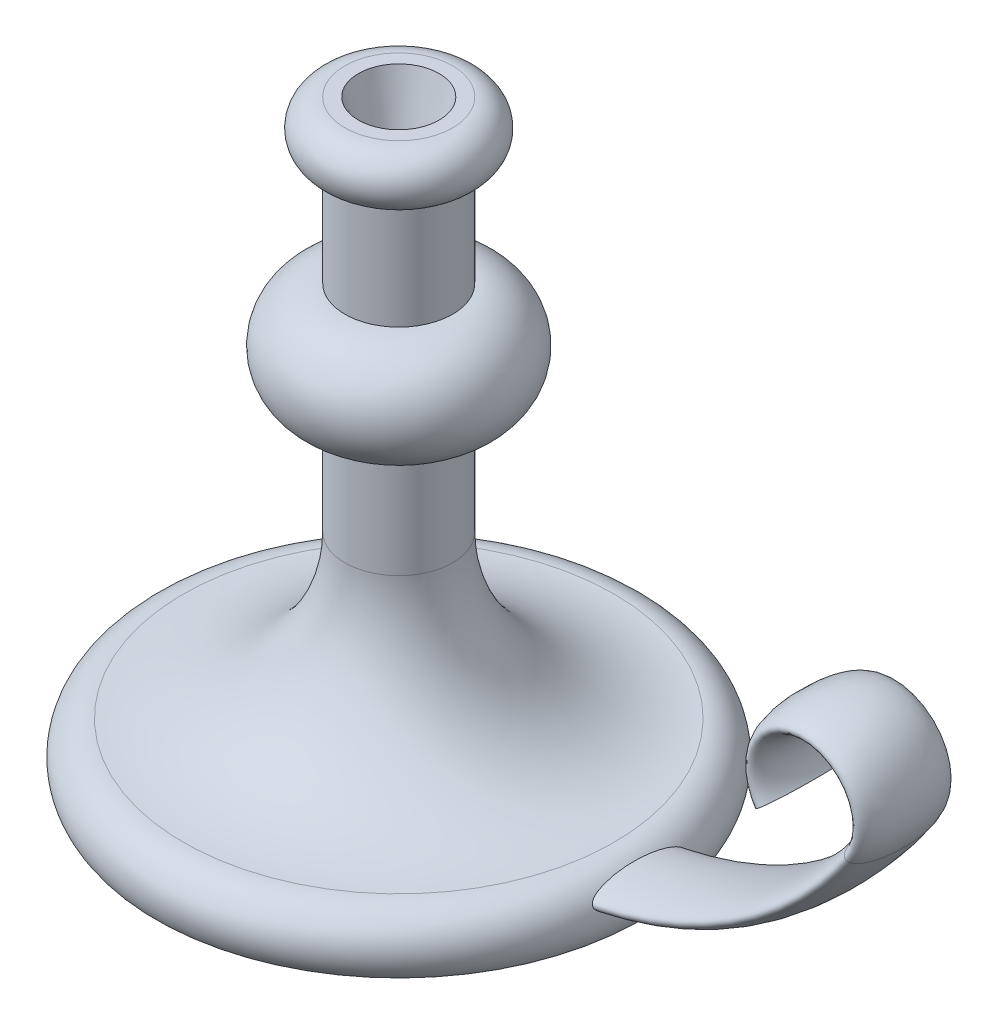
from build123d import *

# Parameters (mm, degrees)
SKETCH3_RX         = 17.5
SKETCH3_RY         = 5
SKETCH5_R          = 15
CUT_EXTRUDE1_DEPTH = 25
CUT_EXTRUDE1_DRAFT = -15


with BuildPart() as part:
    # Sketch1 → Revolve1 (revolve)
    with BuildSketch(Plane.XY, mode=Mode.PRIVATE) as revolve1_sk:
        with BuildLine():
            Line((0, 0), (0, 220))
            Line((0, 220), (20, 220))
            ThreePointArc((20, 220), (30, 210), (20, 200))
            Line((20, 200), (20, 160))
            ThreePointArc((20, 160), (40, 140), (20, 120))
            Line((20, 120), (20, 80))
            ThreePointArc((20, 80), (37.573593129, 37.573593129), (80, 20))
            ThreePointArc((80, 20), (91.180339887, 13.090169944), (90, 0))
            Line((90, 0), (0, 0))
        make_face()
    revolve(revolve1_sk.sketch.rotate(Axis((0, 0, 0), (0, 1, 0)), 90), axis=Axis((0, 0, 0), (0, 1, 0)))

    # Sweep1: sweep along a path in Sketch2
    with BuildLine(Plane.XY) as sweep1_path:
        Line((0, 10), (60, 10))
        ThreePointArc((60, 10), (129.821200219, 27.240819526), (183.592070943, 75))
        ThreePointArc((183.592070943, 75), (167.113128151, 106.333333333), (150.634185358, 75))
    # Sketch3 → Sweep1 (sweep)
    with BuildSketch(Plane(origin=(0, 0, 0), x_dir=(0, 0, -1), z_dir=(1, 0, 0))):
        with Locations((0, 10)):
            Ellipse(SKETCH3_RX, SKETCH3_RY)
    sweep(path=sweep1_path.line)


with BuildPart() as cut_extrude1_tool:
    # Sketch5 → Cut-Extrude1 (with draft: the straight prism first)
    with BuildSketch(Plane(origin=(0, 220, 0), x_dir=(1, 0, 0), z_dir=(0, 1, 0))):
        Circle(SKETCH5_R)
    extrude(amount=-CUT_EXTRUDE1_DEPTH)
    # Cut-Extrude1: the draft: its side faces are tilted about the plane it starts from
    cut_extrude1_sides = [cut_extrude1_tool.faces().sort_by_distance(p)[0] for p in [
        (-15, 207.5, 0),
    ]]
    draft(cut_extrude1_sides, Plane(origin=(0, 220, 0), x_dir=(1, 0, 0), z_dir=(0, 1, 0)), CUT_EXTRUDE1_DRAFT)


with BuildPart() as part_1:
    add(part.part)

    # Cut-Extrude1: cut by cut_extrude1_tool
    add(cut_extrude1_tool.part, mode=Mode.SUBTRACT)


solid = part_1.part
